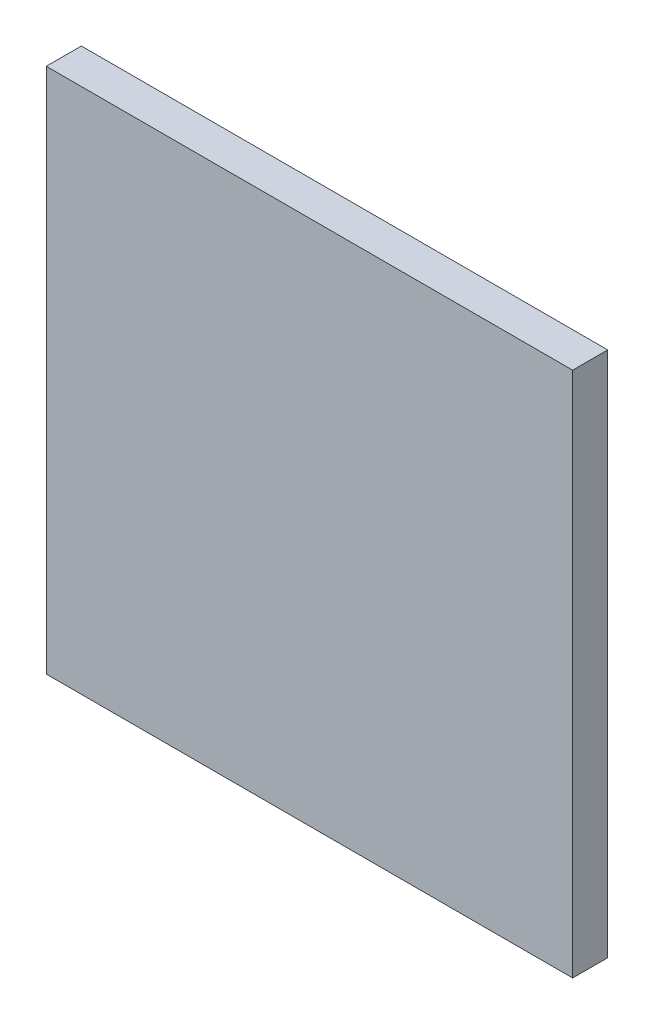
from build123d import *

# Parameters (mm, degrees)
SKETCH1_W           = 285.75
SKETCH1_H           = 285.75
BOSS_EXTRUDE1_DEPTH = 19.05


with BuildPart() as part:
    # Sketch1 → Boss-Extrude1 (new body)
    with BuildSketch(Plane.XY):
        with Locations((142.875, 142.875)):
            Rectangle(SKETCH1_W, SKETCH1_H)
    extrude(amount=BOSS_EXTRUDE1_DEPTH)


solid = part.part
